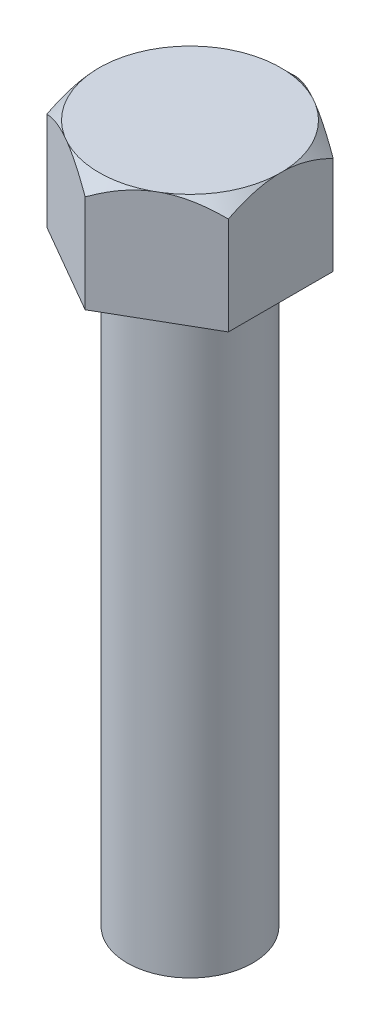
from build123d import *

# Parameters (mm, degrees)
SKETCH2_R           = 2.25
BOSS_EXTRUDE1_DEPTH = 25
BOSS_EXTRUDE3_DEPTH = 4


with BuildPart() as part:
    # Sketch2 → Boss-Extrude1 (new body)
    with BuildSketch(Plane(origin=(0, 0, 0), x_dir=(1, 0, 0), z_dir=(0, 1, 0))):
        with Locations(Location((0, 0, 0), (0, 0, 270))):
            Circle(SKETCH2_R)
    extrude(amount=-BOSS_EXTRUDE1_DEPTH)

    # Sketch3 → Boss-Extrude3 (add)
    with BuildSketch(Plane(origin=(0, 0, 0), x_dir=(1, 0, 0), z_dir=(0, 1, 0))):
        Polygon((0, 3.75277675), (-3.25, 1.876388375), (-3.25, -1.876388375), (0, -3.75277675), (3.25, -1.876388375), (3.25, 1.876388375), align=None)
    extrude(amount=-BOSS_EXTRUDE3_DEPTH)

    # Sketch5 → Cut-Revolve2 (revolve, cut)
    with BuildSketch(Plane(origin=(0, 0, 0), x_dir=(0, 0, -1), z_dir=(1, 0, 0))):
        Polygon((3.25277675, 0), (3.75277675, 0), (3.75277675, -0.5), align=None)
    revolve(axis=Axis((0, 0, 0), (0, -1, 0)), mode=Mode.SUBTRACT)


solid = part.part
